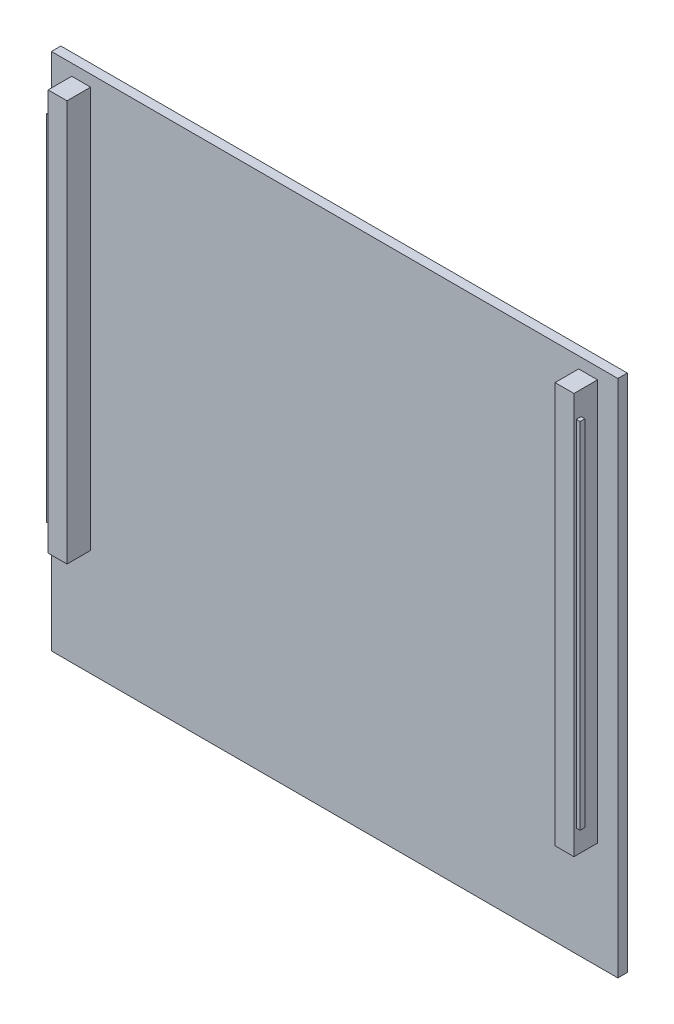
from build123d import *

# Parameters (mm, degrees)
SKIZZE1_W                       = 120
SKIZZE1_H                       = 110
AUFSATZ_LINEAR_AUSTRAGEN1_DEPTH = 2
SKIZZE2_W                       = 4
SKIZZE2_H                       = 85
AUFSATZ_LINEAR_AUSTRAGEN2_DEPTH = 5
SKIZZE3_W                       = 1
SKIZZE3_H                       = 75
AUFSATZ_LINEAR_AUSTRAGEN3_DEPTH = 0.8
SKIZZE4_W                       = 1
SKIZZE4_H                       = 75
AUFSATZ_LINEAR_AUSTRAGEN4_DEPTH = 0.8


with BuildPart() as part:
    # Skizze1 → Aufsatz-Linear austragen1 (new body)
    with BuildSketch(Plane.XY):
        with Locations((2.366105943, 1.130520765)):
            Rectangle(SKIZZE1_W, SKIZZE1_H)
    extrude(amount=AUFSATZ_LINEAR_AUSTRAGEN1_DEPTH)

    # Skizze2 → Aufsatz-Linear austragen2 (add)
    with BuildSketch(Plane.XY.offset(2)):
        with Locations((-51.333894057, 11.230520765)):
            Rectangle(SKIZZE2_W, SKIZZE2_H)
        with Locations((56.066105943, 11.230520765)):
            Rectangle(SKIZZE2_W, SKIZZE2_H)
    extrude(amount=AUFSATZ_LINEAR_AUSTRAGEN2_DEPTH)

    # Skizze3 → Aufsatz-Linear austragen3 (add)
    with BuildSketch(Plane(origin=(58.066105943, 0, 0), x_dir=(0, 0, -1), z_dir=(1, 0, 0))):
        with Locations((-6, 11.230520765)):
            Rectangle(SKIZZE3_W, SKIZZE3_H)
    extrude(amount=AUFSATZ_LINEAR_AUSTRAGEN3_DEPTH)

    # Skizze4 → Aufsatz-Linear austragen4 (add)
    with BuildSketch(Plane.ZY.offset(53.333894057)):
        with Locations((6, 11.230520765)):
            Rectangle(SKIZZE4_W, SKIZZE4_H)
    extrude(amount=AUFSATZ_LINEAR_AUSTRAGEN4_DEPTH)


solid = part.part
